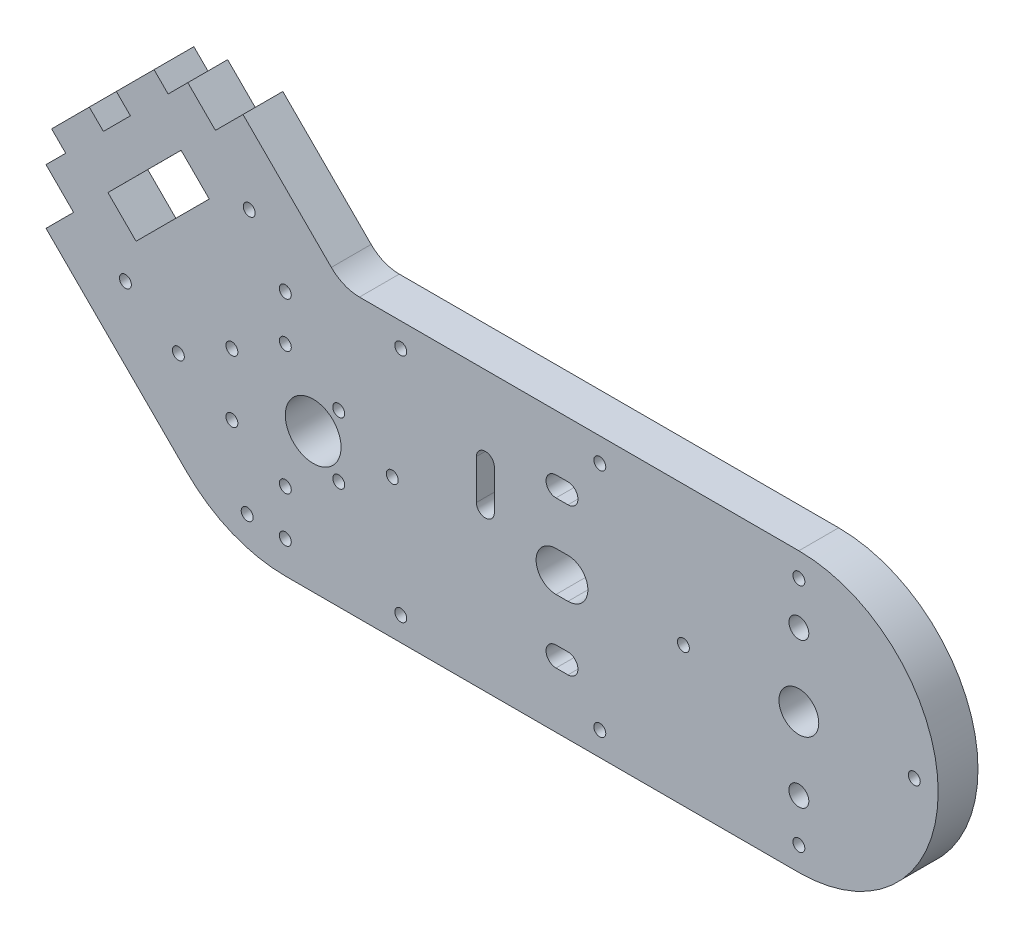
from build123d import *

# Parameters (mm, degrees)
SKETCH1_R           = 5
SKETCH1_R_2         = 1.5
SKETCH1_R_3         = 2.5
SKETCH1_R_4         = 7
BOSS_EXTRUDE1_DEPTH = 10


with BuildPart() as part:
    # Sketch1 → Boss-Extrude1 (new body)
    with BuildSketch(Plane.XY):
        with BuildLine():
            Line((0, -35), (-129, -35))
            ThreePointArc((-129, -35), (-142.388025128, -32.338224799), (-153.739712354, -24.757759039))
            Line((-153.739712354, -24.757759039), (-189.107939553, 10.584687182))
            Line((-189.107939553, 10.584687182), (-182.180820093, 17.516859712))
            Line((-182.180820093, 17.516859712), (-189.112992624, 24.443979172))
            Line((-189.112992624, 24.443979172), (-184.165050154, 29.395530979))
            Line((-184.165050154, 29.395530979), (-187.701872873, 32.929775601))
            Line((-187.701872873, 32.929775601), (-178.230097286, 42.408460491))
            Line((-178.230097286, 42.408460491), (-174.693274566, 38.874215869))
            Line((-174.693274566, 38.874215869), (-167.907524892, 45.664915491))
            Line((-167.907524892, 45.664915491), (-171.444347612, 49.199160113))
            Line((-171.444347612, 49.199160113), (-161.972572025, 58.677845002))
            Line((-161.972572025, 58.677845002), (-158.435749305, 55.14360038))
            Line((-158.435749305, 55.14360038), (-153.487806834, 60.095152188))
            Line((-153.487806834, 60.095152188), (-146.555634303, 53.168032728))
            Line((-146.555634303, 53.168032728), (-139.628514844, 60.100205259))
            Line((-139.628514844, 60.100205259), (-117.439262294, 37.927127131))
            ThreePointArc((-117.439262294, 37.927127131), (-114.195654931, 35.760716243), (-110.37, 35))
            Line((-110.37, 35), (0, 35))
            ThreePointArc((0, 35), (35, 0), (0, -35))
        make_face()
        Circle(SKETCH1_R, mode=Mode.SUBTRACT)
        with Locations((29, 0)):
            Circle(SKETCH1_R_2, mode=Mode.SUBTRACT)
        with Locations((0, -18.25)):
            Circle(SKETCH1_R_3, mode=Mode.SUBTRACT)
        with Locations((0, 18.25)):
            Circle(SKETCH1_R_3, mode=Mode.SUBTRACT)
        with Locations((0, 29)):
            Circle(SKETCH1_R_2, mode=Mode.SUBTRACT)
        with Locations((0, -29)):
            Circle(SKETCH1_R_2, mode=Mode.SUBTRACT)
        with Locations((-50, -29)):
            Circle(SKETCH1_R_2, mode=Mode.SUBTRACT)
        with Locations((-50, 29)):
            Circle(SKETCH1_R_2, mode=Mode.SUBTRACT)
        with Locations((-100, -29)):
            Circle(SKETCH1_R_2, mode=Mode.SUBTRACT)
        with Locations((-100, 29)):
            Circle(SKETCH1_R_2, mode=Mode.SUBTRACT)
        with Locations((-29, 0)):
            Circle(SKETCH1_R_2, mode=Mode.SUBTRACT)
        with Locations((-169.166963878, 9.036324012)):
            Circle(SKETCH1_R_2, mode=Mode.SUBTRACT)
        with Locations((-138.065609793, 40.160362537)):
            Circle(SKETCH1_R_2, mode=Mode.SUBTRACT)
        with Locations((-122, 0)):
            Circle(SKETCH1_R_4, mode=Mode.SUBTRACT)
        with Locations((-129, 26.870057685)):
            Circle(SKETCH1_R_2, mode=Mode.SUBTRACT)
        with Locations((-155.870057685, 0)):
            Circle(SKETCH1_R_2, mode=Mode.SUBTRACT)
        with Locations((-129, -26.870057685)):
            Circle(SKETCH1_R_2, mode=Mode.SUBTRACT)
        with Locations((-102.129942315, 0)):
            Circle(SKETCH1_R_2, mode=Mode.SUBTRACT)
        with Locations((-138.576564013, -26.311393382)):
            Circle(SKETCH1_R_2, mode=Mode.SUBTRACT)
        with Locations((-129, 15.5)):
            Circle(SKETCH1_R_2, mode=Mode.SUBTRACT)
        with Locations((-129, -15.5)):
            Circle(SKETCH1_R_2, mode=Mode.SUBTRACT)
        with Locations((-142.42, 7.755875192)):
            Circle(SKETCH1_R_2, mode=Mode.SUBTRACT)
        with Locations((-142.42, -7.755875192)):
            Circle(SKETCH1_R_2, mode=Mode.SUBTRACT)
        with Locations((-115.58, -7.755875192)):
            Circle(SKETCH1_R_2, mode=Mode.SUBTRACT)
        with Locations((-115.58, 7.755875192)):
            Circle(SKETCH1_R_2, mode=Mode.SUBTRACT)
        with BuildLine():
            Line((-58, -5), (-61, -5))
            ThreePointArc((-61, -5), (-66, 0), (-61, 5))
            Line((-61, 5), (-58, 5))
            ThreePointArc((-58, 5), (-53, 0), (-58, -5))
        make_face(mode=Mode.SUBTRACT)
        with BuildLine():
            Line((-58, 16), (-61, 16))
            ThreePointArc((-61, 16), (-63.5, 18.5), (-61, 21))
            Line((-61, 21), (-58, 21))
            ThreePointArc((-58, 21), (-55.5, 18.5), (-58, 16))
        make_face(mode=Mode.SUBTRACT)
        with BuildLine():
            Line((-58, -21), (-61, -21))
            ThreePointArc((-61, -21), (-63.5, -18.5), (-61, -16))
            Line((-61, -16), (-58, -16))
            ThreePointArc((-58, -16), (-55.5, -18.5), (-58, -21))
        make_face(mode=Mode.SUBTRACT)
        with BuildLine():
            Line((-81, 5), (-81, 15))
            ThreePointArc((-81, 15), (-78.75, 17.25), (-76.5, 15))
            Line((-76.5, 15), (-76.5, 5))
            ThreePointArc((-76.5, 5), (-78.75, 2.75), (-81, 5))
        make_face(mode=Mode.SUBTRACT)
        Polygon((-173.557263216, 26.146707149), (-155.179191181, 44.538185292), (-148.108123369, 37.46711748), (-166.492898458, 19.082342391), align=None, mode=Mode.SUBTRACT)
    extrude(amount=BOSS_EXTRUDE1_DEPTH)


solid = part.part
